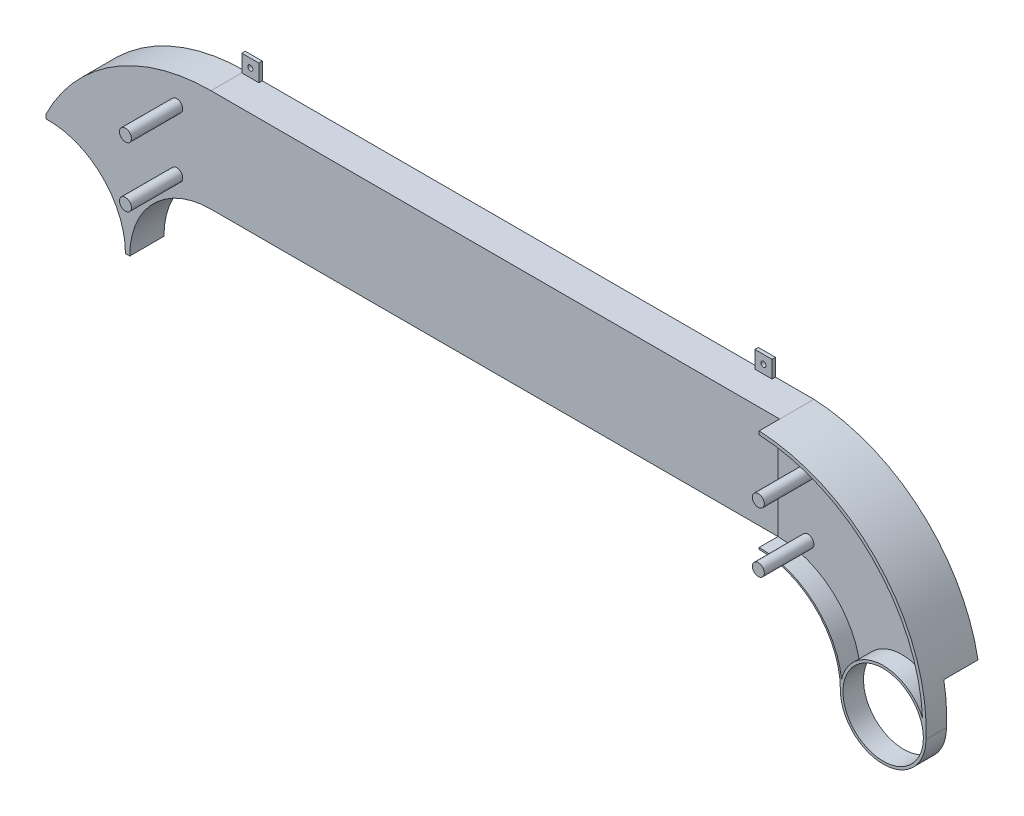
from build123d import *

# Parameters (mm, degrees)
BOSS_EXTRUDE1_DEPTH      = 1
SKETCH1_5_R              = 47.5
SKETCH1_5_R_2            = 25
BOSS_EXTRUDE2_DEPTH      = 3
SKETCH1_6_R              = 45
BOSS_EXTRUDE3_DEPTH      = 20
BOSS_EXTRUDE4_DEPTH      = 12
BOSS_EXTRUDE4_DEPTH_BACK = 20
SKETCH1_7_R              = 23.5
SKETCH4_W                = 10
SKETCH4_H                = 10
SKETCH4_R                = 1.5
BOSS_EXTRUDE5_DEPTH      = 2
RIB1_REACH               = 541.058
SKETCH5_R                = 25
SKETCH5_W                = 65.707634962
SKETCH5_H                = 50.574965667
CUT_EXTRUDE2_DEPTH       = 20
BOSS_EXTRUDE7_START      = 12
BOSS_EXTRUDE7_DEPTH      = 12
BOSS_EXTRUDE8_START      = 1
BOSS_EXTRUDE8_DEPTH      = 1
SKETCH6_W                = 432.5
SKETCH6_H                = 112.5
CUT_EXTRUDE3_DEPTH       = 20
SKETCH7_R                = 3.5
BOSS_EXTRUDE9_DEPTH      = 30


with BuildPart() as part:
    # Sketch1 → Boss-Extrude1 (new body)
    with BuildSketch(Plane.XY):
        with BuildLine():
            ThreePointArc((95, 105.5), (39.684082468, 89.835400971), (0.794736842, 47.493351044))
            ThreePointArc((0.794736842, 47.493351044), (31.348293783, 35.686614815), (46.994736842, 6.909754637))
            ThreePointArc((46.994736842, 6.909754637), (63.242112003, 36.656330285), (95, 48.5))
            Line((95, 48.5), (427.5, 48.5))
            ThreePointArc((427.5, 48.5), (459.710681482, 36.25909539), (475.662068966, 5.715340144))
            ThreePointArc((475.662068966, 5.715340144), (497.865985258, 24.908753102), (523.011089442, 9.771886344))
            ThreePointArc((523.011089442, 9.771886344), (493.732825543, 76.071334342), (427.5, 105.5))
            Line((427.5, 105.5), (95, 105.5))
        make_face()
    extrude(amount=-BOSS_EXTRUDE1_DEPTH)

    # Sketch1<5> → Boss-Extrude2 (add)
    with BuildSketch(Plane.XY):
        Circle(SKETCH1_5_R)
        Circle(SKETCH1_5_R_2, mode=Mode.SUBTRACT)
    extrude(amount=-BOSS_EXTRUDE2_DEPTH)

    # Sketch1<6> → Boss-Extrude3 (add)
    with BuildSketch(Plane.XY):
        with BuildLine():
            Line((427.5, 107.5), (95, 107.5))
            ThreePointArc((95, 107.5), (38.200479459, 91.269186839), (-1.447368421, 47.47794356))
            ThreePointArc((-1.447368421, 47.47794356), (-33.071891388, -34.095454242), (47.5, 0))
            ThreePointArc((47.5, 0), (61.412427894, 33.587572106), (95, 47.5))
            Line((95, 47.5), (427.5, 47.5))
            ThreePointArc((427.5, 47.5), (461.087572106, 33.587572106), (475, 0))
            ThreePointArc((475, 0), (475.166068818, 2.876779809), (475.662068966, 5.715340144))
            ThreePointArc((475.662068966, 5.715340144), (459.710681482, 36.25909539), (427.5, 48.5))
            Line((427.5, 48.5), (95, 48.5))
            ThreePointArc((95, 48.5), (63.242112003, 36.656330285), (46.994736842, 6.909754637))
            ThreePointArc((46.994736842, 6.909754637), (31.348293783, 35.686614815), (0.794736842, 47.493351044))
            ThreePointArc((0.794736842, 47.493351044), (39.684082468, 89.835400971), (95, 105.5))
            Line((95, 105.5), (427.5, 105.5))
            ThreePointArc((427.5, 105.5), (493.732825543, 76.071334342), (523.011089442, 9.771886344))
            ThreePointArc((523.011089442, 9.771886344), (524.497726793, 4.98611893), (525, 0))
            ThreePointArc((525, 0), (498.513978978, 73.942911166), (427.5, 107.5))
        make_face()
        Circle(SKETCH1_6_R, mode=Mode.SUBTRACT)
    extrude(amount=-BOSS_EXTRUDE3_DEPTH)

    # Sketch1<7> → Boss-Extrude4 (add, two sides: drawn at the far end of the back side and taken through both)
    with BuildSketch(Plane.XY.offset(-BOSS_EXTRUDE4_DEPTH_BACK)):
        with BuildLine():
            ThreePointArc((475, 0), (500, -25), (525, 0))
            ThreePointArc((525, 0), (524.497726793, 4.98611893), (523.011089442, 9.771886344))
            ThreePointArc((523.011089442, 9.771886344), (497.865985258, 24.908753102), (475.662068966, 5.715340144))
            ThreePointArc((475.662068966, 5.715340144), (475.166068818, 2.876779809), (475, 0))
        make_face()
        with Locations((500, 0)):
            Circle(SKETCH1_7_R, mode=Mode.SUBTRACT)
    extrude(amount=BOSS_EXTRUDE4_DEPTH + BOSS_EXTRUDE4_DEPTH_BACK)

    # Sketch4 → Boss-Extrude5 (add)
    # profile 1 of 4: a face of its own
    with BuildSketch(Plane(origin=(0, 0, -20), x_dir=(-1, 0, 0), z_dir=(0, 0, -1))):
        with Locations((-100, 112.5)):
            Rectangle(SKETCH4_W, SKETCH4_H)
        with Locations((-100, 112.5)):
            Circle(SKETCH4_R, mode=Mode.SUBTRACT)
    # profile 2 of 4: a face of its own
    with BuildSketch(Plane(origin=(0, 0, -20), x_dir=(-1, 0, 0), z_dir=(0, 0, -1))):
        with Locations((-100, 42.5)):
            Rectangle(SKETCH4_W, SKETCH4_H)
        with Locations((-100, 42.5)):
            Circle(SKETCH4_R, mode=Mode.SUBTRACT)
    # profile 3 of 4: a face of its own
    with BuildSketch(Plane(origin=(0, 0, -20), x_dir=(-1, 0, 0), z_dir=(0, 0, -1))):
        with Locations((-400, 42.5)):
            Rectangle(SKETCH4_W, SKETCH4_H)
        with Locations((-400, 42.5)):
            Circle(SKETCH4_R, mode=Mode.SUBTRACT)
    # profile 4 of 4: a face of its own
    with BuildSketch(Plane(origin=(0, 0, -20), x_dir=(-1, 0, 0), z_dir=(0, 0, -1))):
        with Locations((-400, 112.5)):
            Rectangle(SKETCH4_W, SKETCH4_H)
        with Locations((-400, 112.5)):
            Circle(SKETCH4_R, mode=Mode.SUBTRACT)
    extrude(amount=-BOSS_EXTRUDE5_DEPTH)

    # Sketch2 walls → Rib1 (add, up to next)
    with BuildSketch(Plane(origin=(0, 0, -20), x_dir=(-1, 0, 0), z_dir=(0, 0, -1)), mode=Mode.PRIVATE) as rib1_sk1:
        Polygon((-861.045730636, -376.632398349), (-427.481030572, 104.773923791), (-370.5, 47.792893219), (-313.5, 104.792893219), (-256.5, 47.792893219), (-199.5, 104.792893219), (-142.5, 47.792893219), (-85.893739398, 104.399153821), (358.946648956, -340.441234532), (359.653755737, -339.734127751), (-85.893739398, 105.813367384), (-142.5, 49.207106781), (-199.5, 106.207106781), (-256.5, 49.207106781), (-313.5, 106.207106781), (-370.5, 49.207106781), (-427.518969428, 106.226076209), (-861.788795248, -375.963178667), align=None)
    rib1_tool1 = extrude(rib1_sk1.sketch, amount=-RIB1_REACH, mode=Mode.PRIVATE) - part.part
    add(rib1_tool1.solids().sort_by_distance((228, 77, -20))[0])

    # Sketch5 → Cut-Extrude2 (cut)
    # profile 1 of 2: a face of its own
    with BuildSketch(Plane.XY):
        with BuildLine():
            ThreePointArc((45, 0), (31.331265526, 32.300956651), (-1.371191136, 44.979104425))
            Line((-1.371191136, 44.979104425), (-1.447368421, 47.47794356))
            ThreePointArc((-1.447368421, 47.47794356), (-33.071891388, -34.095454242), (47.5, 0))
            Line((47.5, 0), (45, 0))
        make_face()
        Circle(SKETCH5_R, mode=Mode.SUBTRACT)
    # profile 2 of 2: a face of its own
    with BuildSketch(Plane.XY):
        with Locations((499.303565133, -1.787482834)):
            Rectangle(SKETCH5_W, SKETCH5_H)
    extrude(amount=-CUT_EXTRUDE2_DEPTH, mode=Mode.SUBTRACT)

    # Sketch1<10> → Boss-Extrude7 (add)
    with BuildSketch(Plane.XY.offset(BOSS_EXTRUDE7_START)):
        with BuildLine():
            Line((427.5, 107.5), (95, 107.5))
            ThreePointArc((95, 107.5), (38.200479459, 91.269186839), (-1.447368421, 47.47794356))
            ThreePointArc((-1.447368421, 47.47794356), (-0.326406713, 47.498878499), (0.794736842, 47.493351044))
            ThreePointArc((0.794736842, 47.493351044), (39.684082468, 89.835400971), (95, 105.5))
            Line((95, 105.5), (427.5, 105.5))
            ThreePointArc((427.5, 105.5), (493.732825543, 76.071334342), (523.011089442, 9.771886344))
            ThreePointArc((523.011089442, 9.771886344), (524.497726793, 4.98611893), (525, 0))
            ThreePointArc((525, 0), (498.513978978, 73.942911166), (427.5, 107.5))
        make_face()
        with BuildLine():
            ThreePointArc((46.994736842, 6.909754637), (47.373515808, 3.464101615), (47.5, 0))
            ThreePointArc((47.5, 0), (61.412427894, 33.587572106), (95, 47.5))
            Line((95, 47.5), (427.5, 47.5))
            ThreePointArc((427.5, 47.5), (461.087572106, 33.587572106), (475, 0))
            ThreePointArc((475, 0), (475.166068818, 2.876779809), (475.662068966, 5.715340144))
            ThreePointArc((475.662068966, 5.715340144), (459.710681482, 36.25909539), (427.5, 48.5))
            Line((427.5, 48.5), (95, 48.5))
            ThreePointArc((95, 48.5), (63.242112003, 36.656330285), (46.994736842, 6.909754637))
        make_face()
    extrude(amount=-BOSS_EXTRUDE7_DEPTH)

    # Sketch1<11> → Boss-Extrude8 (add)
    with BuildSketch(Plane.XY.offset(BOSS_EXTRUDE8_START)):
        with BuildLine():
            ThreePointArc((95, 105.5), (39.684082468, 89.835400971), (0.794736842, 47.493351044))
            ThreePointArc((0.794736842, 47.493351044), (31.348293783, 35.686614815), (46.994736842, 6.909754637))
            ThreePointArc((46.994736842, 6.909754637), (63.242112003, 36.656330285), (95, 48.5))
            Line((95, 48.5), (427.5, 48.5))
            ThreePointArc((427.5, 48.5), (459.710681482, 36.25909539), (475.662068966, 5.715340144))
            ThreePointArc((475.662068966, 5.715340144), (497.865985258, 24.908753102), (523.011089442, 9.771886344))
            ThreePointArc((523.011089442, 9.771886344), (493.732825543, 76.071334342), (427.5, 105.5))
            Line((427.5, 105.5), (95, 105.5))
        make_face()
    extrude(amount=-BOSS_EXTRUDE8_DEPTH)

    # Sketch6 → Cut-Extrude3 (cut)
    with BuildSketch(Plane.XY):
        with Locations((211.25, 51.25)):
            Rectangle(SKETCH6_W, SKETCH6_H)
    extrude(amount=CUT_EXTRUDE3_DEPTH, mode=Mode.SUBTRACT)

    # Sketch7 → Boss-Extrude9 (add)
    with BuildSketch(Plane.XY):
        with Locations((75, 55)):
            Circle(SKETCH7_R)
        with Locations((75, 90)):
            Circle(SKETCH7_R)
        with Locations((445, 55)):
            Circle(SKETCH7_R)
        with Locations((445, 90)):
            Circle(SKETCH7_R)
    extrude(amount=BOSS_EXTRUDE9_DEPTH)


solid = part.part
